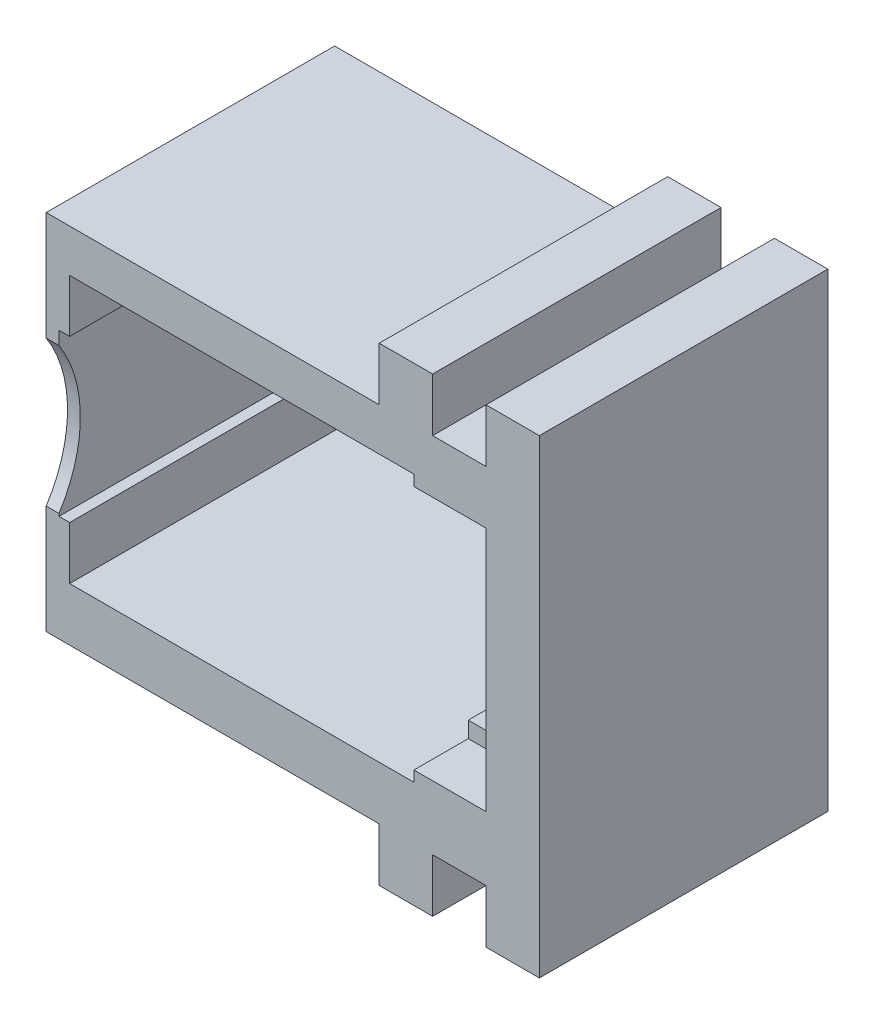
from build123d import *

# Parameters (mm, degrees)
SKETCH1_W                 = 38.2
SKETCH1_H                 = 30
BOSS_EXTRUDE1_DEPTH       = 2
SKETCH2_W                 = 2
SKETCH2_H                 = 20
BOSS_EXTRUDE2_DEPTH       = 27.02
CUT_EXTRUDE1_REACH        = 58.632
SKETCH3_W                 = 7.09
SKETCH3_H                 = 23
CUT_EXTRUDE3_REACH        = 58.632
CUT_EXTRUDE4_DEPTH        = 57.632318808
CUT_EXTRUDE4_DEPTH_BACK   = 57.632318808
SKETCH7_W                 = 32.25
SKETCH7_H                 = 3
BOSS_EXTRUDE3_DEPTH       = 25.02
SKETCH8_W                 = 20
SKETCH8_H                 = 30
BOSS_EXTRUDE4_DEPTH       = 5
BOSS_EXTRUDE5_DEPTH       = 2
BOSS_EXTRUDE6_DEPTH       = 3
BOSS_EXTRUDE7_DEPTH       = 2
SKETCH12_W                = 5
SKETCH12_H                = 27.02
BOSS_EXTRUDE8_DEPTH       = 5
SKETCH13_W                = 5
SKETCH13_H                = 22
BOSS_EXTRUDE10_DEPTH      = 44
SKETCH15_W                = 5
SKETCH15_H                = 27.02
BOSS_EXTRUDE11_DEPTH      = 5
BOSS_EXTRUDE12_DEPTH      = 5.02
BOSS_EXTRUDE12_DEPTH_BACK = 2
SKETCH16_W                = 5
SKETCH16_H                = 44
SKETCH17_W                = 20
SKETCH17_H                = 34
CUT_EXTRUDE5_DEPTH        = 5


with BuildPart() as part:
    # Sketch1 → Boss-Extrude1 (new body)
    with BuildSketch(Plane.XY):
        with Locations((-9.254890621, -15.096829294)):
            Rectangle(SKETCH1_W, SKETCH1_H)
    extrude(amount=BOSS_EXTRUDE1_DEPTH)

    # Sketch2 → Boss-Extrude2 (add)
    with BuildSketch(Plane.XY.offset(2)):
        Polygon((-26.154890621, -2.096829294), (-28.354890621, -2.096829294), (-28.354890621, -30.096829294), (-26.154890621, -30.096829294), (-26.154890621, -22.146829294), (-27.154890621, -22.146829294), (-27.154890621, -7.046829294), (-26.154890621, -7.046829294), align=None)
        Polygon((9.845109379, -0.096829294), (-28.354890621, -0.096829294), (-28.354890621, -2.096829294), (-26.154890621, -2.096829294), (6.095109379, -2.096829294), (9.845109379, -2.096829294), align=None)
        Polygon((9.845109379, -4.596829294), (9.845109379, -2.096829294), (6.095109379, -2.096829294), (6.095109379, -4.596829294), (7.845109379, -4.596829294), align=None)
        with Locations((8.845109379, -14.596829294)):
            Rectangle(SKETCH2_W, SKETCH2_H)
        Polygon((9.845109379, -30.096829294), (9.845109379, -24.596829294), (7.845109379, -24.596829294), (6.095109379, -24.596829294), (6.095109379, -30.096829294), align=None)
    extrude(amount=BOSS_EXTRUDE2_DEPTH)

    # Sketch3 → Cut-Extrude1 (cut, up to next)
    with BuildSketch(Plane(origin=(9.845109379, 0, 0), x_dir=(0, 0, -1), z_dir=(1, 0, 0)), mode=Mode.PRIVATE) as cut_extrude1_sk1:
        with Locations((-25.475, -14.596829294)):
            Rectangle(SKETCH3_W, SKETCH3_H)
    cut_extrude1_tool1 = extrude(cut_extrude1_sk1.sketch, amount=-CUT_EXTRUDE1_REACH, mode=Mode.PRIVATE) & part.part
    add(cut_extrude1_tool1.solids().sort_by_distance((9.845109, -14.596829, 25.475))[0], mode=Mode.SUBTRACT)

    # Sketch4 → Cut-Extrude3 (cut, up to next)
    with BuildSketch(Plane.ZY.offset(28.354890621), mode=Mode.PRIVATE) as cut_extrude3_sk1:
        with BuildLine():
            ThreePointArc((25.02, -15.096829294), (26.063183829, -20.116789453), (29.02, -24.30552084))
            Line((29.02, -24.30552084), (29.02, -15.096829294))
            Line((29.02, -15.096829294), (25.02, -15.096829294))
        make_face()
    cut_extrude3_tool1 = extrude(cut_extrude3_sk1.sketch, amount=-CUT_EXTRUDE3_REACH, mode=Mode.PRIVATE) & part.part
    # Sketch4 → Cut-Extrude3 (cut, up to next)
    with BuildSketch(Plane.ZY.offset(28.354890621), mode=Mode.PRIVATE) as cut_extrude3_sk2:
        with BuildLine():
            ThreePointArc((29.02, -5.888137747), (26.063183829, -10.076869135), (25.02, -15.096829294))
            Line((25.02, -15.096829294), (29.02, -15.096829294))
            Line((29.02, -15.096829294), (29.02, -5.888137747))
        make_face()
    cut_extrude3_tool2 = extrude(cut_extrude3_sk2.sketch, amount=-CUT_EXTRUDE3_REACH, mode=Mode.PRIVATE) & part.part
    # Sketch4 → Cut-Extrude3 (cut, up to next)
    with BuildSketch(Plane.ZY.offset(28.354890621), mode=Mode.PRIVATE) as cut_extrude3_sk3:
        with BuildLine():
            ThreePointArc((25.02, -15.096829294), (26.063183829, -20.116789453), (29.02, -24.30552084))
            Line((29.02, -24.30552084), (29.02, -15.096829294))
            Line((29.02, -15.096829294), (25.02, -15.096829294))
        make_face()
    cut_extrude3_tool3 = extrude(cut_extrude3_sk3.sketch, amount=-CUT_EXTRUDE3_REACH, mode=Mode.PRIVATE) & part.part
    # Sketch4 → Cut-Extrude3 (cut, up to next)
    with BuildSketch(Plane.ZY.offset(28.354890621), mode=Mode.PRIVATE) as cut_extrude3_sk4:
        with BuildLine():
            ThreePointArc((29.02, -5.888137747), (26.063183829, -10.076869135), (25.02, -15.096829294))
            Line((25.02, -15.096829294), (29.02, -15.096829294))
            Line((29.02, -15.096829294), (29.02, -5.888137747))
        make_face()
    cut_extrude3_tool4 = extrude(cut_extrude3_sk4.sketch, amount=-CUT_EXTRUDE3_REACH, mode=Mode.PRIVATE) & part.part
    add(cut_extrude3_tool1.solids().sort_by_distance((-28.354891, -18.637073, 27.396015))[0], mode=Mode.SUBTRACT)
    add(cut_extrude3_tool2.solids().sort_by_distance((-28.354891, -11.556586, 27.396015))[0], mode=Mode.SUBTRACT)
    add(cut_extrude3_tool3.solids().sort_by_distance((-28.354891, -18.637073, 27.396015))[0], mode=Mode.SUBTRACT)
    add(cut_extrude3_tool4.solids().sort_by_distance((-28.354891, -11.556586, 27.396015))[0], mode=Mode.SUBTRACT)

    # Sketch6 → Cut-Extrude4 (cut, two sides: drawn at the far end of the back side and taken through both)
    with BuildSketch(Plane.ZY.offset(28.354890621).offset(-CUT_EXTRUDE4_DEPTH_BACK)):
        with BuildLine():
            Line((29.02, -30.096829294), (29.02, -24.30552084))
            ThreePointArc((29.02, -24.30552084), (27.945480542, -23.169231244), (27.02, -21.90858384))
            Line((27.02, -21.90858384), (27.02, -30.096829294))
            Line((27.02, -30.096829294), (29.02, -30.096829294))
        make_face()
        with BuildLine():
            Line((29.02, -5.888137747), (29.02, -0.096829294))
            Line((29.02, -0.096829294), (27.02, -0.096829294))
            Line((27.02, -0.096829294), (27.02, -8.285074747))
            ThreePointArc((27.02, -8.285074747), (27.945480542, -7.024427343), (29.02, -5.888137747))
        make_face()
    extrude(amount=CUT_EXTRUDE4_DEPTH + CUT_EXTRUDE4_DEPTH_BACK, mode=Mode.SUBTRACT)

    # Sketch7 → Boss-Extrude3 (add)
    with BuildSketch(Plane.XY.offset(2)):
        with Locations((-10.029890621, -28.596829294)):
            Rectangle(SKETCH7_W, SKETCH7_H)
    extrude(amount=BOSS_EXTRUDE3_DEPTH)

    # Sketch8 → Boss-Extrude4 (add)
    with BuildSketch(Plane.ZY.offset(28.354890621)):
        with Locations((10, -15.096829294)):
            Rectangle(SKETCH8_W, SKETCH8_H)
    extrude(amount=BOSS_EXTRUDE4_DEPTH)

    # Sketch9 → Boss-Extrude5 (add)
    with BuildSketch(Plane.XZ.offset(30.096829294)):
        Polygon((-33.354890621, 20), (-28.354890621, 20), (-28.354890621, 27.02), (9.845109379, 27.02), (9.845109379, 0), (-33.354890621, 0), align=None)
    extrude(amount=BOSS_EXTRUDE5_DEPTH)

    # Sketch10 → Boss-Extrude6 (add)
    with BuildSketch(Plane(origin=(9.845109379, 0, 0), x_dir=(0, 0, -1), z_dir=(1, 0, 0))):
        Polygon((-21.93, -3.096829294), (-21.93, -26.096829294), (-27.02, -26.096829294), (-27.02, -32.096829294), (0, -32.096829294), (0, -0.096829294), (-27.02, -0.096829294), (-27.02, -3.096829294), align=None)
    extrude(amount=BOSS_EXTRUDE6_DEPTH)

    # Sketch11 → Boss-Extrude7 (add)
    with BuildSketch(Plane(origin=(0, -0.096829294, 0), x_dir=(1, 0, 0), z_dir=(0, 1, 0))):
        Polygon((-33.354890621, 0), (-33.354890621, -20), (-28.354890621, -20), (-28.354890621, -27.02), (12.845109379, -27.02), (12.845109379, 0), align=None)
    extrude(amount=BOSS_EXTRUDE7_DEPTH)

    # Sketch12 → Boss-Extrude8 (add)
    with BuildSketch(Plane(origin=(0, 1.903170706, 0), x_dir=(1, 0, 0), z_dir=(0, 1, 0))):
        with Locations((5.345109379, -13.51)):
            Rectangle(SKETCH12_W, SKETCH12_H)
    extrude(amount=BOSS_EXTRUDE8_DEPTH)

    # Sketch13 → Boss-Extrude10 (add)
    with BuildSketch(Plane(origin=(0, 6.903170706, 0), x_dir=(1, 0, 0), z_dir=(0, 1, 0))):
        with Locations((15.345109379, -11)):
            Rectangle(SKETCH13_W, SKETCH13_H)
    extrude(amount=-BOSS_EXTRUDE10_DEPTH)

    # Sketch15 → Boss-Extrude11 (add)
    with BuildSketch(Plane(origin=(0, -32.096829294, 0), x_dir=(-1, 0, 0), z_dir=(0, -1, 0))):
        with Locations((-5.345109379, -13.51)):
            Rectangle(SKETCH15_W, SKETCH15_H)
    extrude(amount=BOSS_EXTRUDE11_DEPTH)

    # Sketch16 → Boss-Extrude12 (add, two sides: drawn at the far end of the back side and taken through both)
    with BuildSketch(Plane.XY.offset(22).offset(-BOSS_EXTRUDE12_DEPTH_BACK)):
        with Locations((15.345109379, -15.096829294)):
            Rectangle(SKETCH16_W, SKETCH16_H)
    extrude(amount=BOSS_EXTRUDE12_DEPTH + BOSS_EXTRUDE12_DEPTH_BACK)

    # Sketch17 → Cut-Extrude5 (cut)
    with BuildSketch(Plane.ZY.offset(33.354890621)):
        with Locations((10, -15.096829294)):
            Rectangle(SKETCH17_W, SKETCH17_H)
    extrude(amount=-CUT_EXTRUDE5_DEPTH, mode=Mode.SUBTRACT)


solid = part.part
